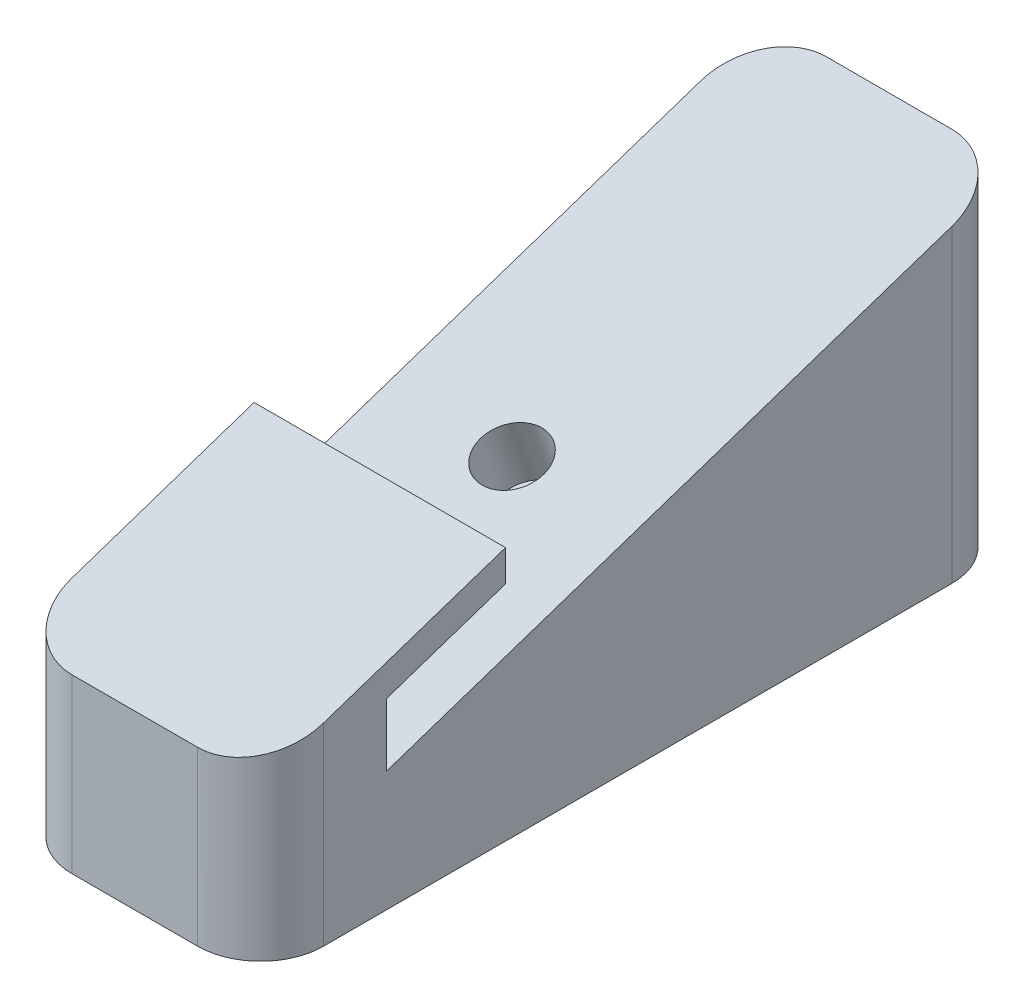
from build123d import *

# Parameters (mm, degrees)
SKETCH1_W               = 25.4
SKETCH1_H               = 76.2
BOSS_EXTRUDE1_DEPTH     = 33.3756
CUT_EXTRUDE2_DEPTH      = 57.663045059
CUT_EXTRUDE2_DEPTH_BACK = 57.663045059
SKETCH5_R               = 3.175
CUT_EXTRUDE3_DEPTH      = 6.35
BOSS_EXTRUDE2_REACH     = 63.744
SKETCH1_5_W             = 25.4
SKETCH1_5_H             = 12.7
SKETCH7_W               = 25.4
SKETCH7_H               = 3.175
BOSS_EXTRUDE3_DEPTH     = 12.7
FILLET1_R               = 6.35


with BuildPart() as part:
    # Sketch1 → Boss-Extrude1 (new body)
    with BuildSketch(Plane(origin=(0, 0, 0), x_dir=(1, 0, 0), z_dir=(0, 1, 0))):
        Rectangle(SKETCH1_W, SKETCH1_H)
    extrude(amount=BOSS_EXTRUDE1_DEPTH)

    # Sketch4 → Cut-Extrude2 (cut, two sides: drawn at the far end of the back side and taken through both)
    with BuildSketch(Plane(origin=(12.7, 0, 0), x_dir=(0, 0, -1), z_dir=(1, 0, 0)).offset(-CUT_EXTRUDE2_DEPTH_BACK)):
        Polygon((38.1, 33.3756), (-38.1, 33.3756), (-38.1, 7.879436654), align=None)
    extrude(amount=CUT_EXTRUDE2_DEPTH + CUT_EXTRUDE2_DEPTH_BACK, mode=Mode.SUBTRACT)

    # Sketch5 → Cut-Extrude3 (cut)
    with BuildSketch(Plane(origin=(0, 18.550693474, 6.20697521), x_dir=(1, 0, 0), z_dir=(0, 0.9483236552061992, 0.3173046564050927))):
        with Locations((0, 6.545207615)):
            Circle(SKETCH5_R)
    extrude(amount=-CUT_EXTRUDE3_DEPTH, mode=Mode.SUBTRACT)

    # Boss-Extrude2: from a plane face, 63.744 long prism both ways, kept between that surface and its translate by the depth
    boss_extrude2_start = Plane(origin=(-12.7, 7.879436654, 38.1), z_dir=(0, -0.9483236552061992, -0.3173046564050927)) * Box(256.976, 256.976, 128.488, align=(Align.CENTER, Align.CENTER, Align.MIN), mode=Mode.PRIVATE)
    boss_extrude2_end = Plane(origin=(-12.7, 17.404436654, 38.1), z_dir=(0, -0.9483236552061992, -0.3173046564050927)) * Box(256.976, 256.976, 128.488, align=(Align.CENTER, Align.CENTER, Align.MIN), mode=Mode.PRIVATE)
    # Sketch1<5> → Boss-Extrude2 (add, from a surface)
    with BuildSketch(Plane(origin=(0, 0, 0), x_dir=(1, 0, 0), z_dir=(0, 1, 0)), mode=Mode.PRIVATE) as boss_extrude2_sk1:
        with Locations((0, -31.75)):
            Rectangle(SKETCH1_5_W, SKETCH1_5_H)
    boss_extrude2_tool1 = extrude(boss_extrude2_sk1.sketch, amount=BOSS_EXTRUDE2_REACH, both=True, mode=Mode.PRIVATE)
    add(((boss_extrude2_tool1 - boss_extrude2_start) & boss_extrude2_end).solids().sort_by_distance((0, 19.620076, 3.010928))[0])

    # Sketch7 → Boss-Extrude3 (add, along a direction that is not the sketch's normal)
    with BuildSketch(Plane(origin=(0, 0, 25.4), x_dir=(-1, 0, 0), z_dir=(0, 0, -1))):
        with Locations((0, 20.066297212)):
            Rectangle(SKETCH7_W, SKETCH7_H)
    extrude(amount=BOSS_EXTRUDE3_DEPTH, dir=(0, 0.31730465640509264, -0.9483236552061991))

    # Fillet1
    fillet1_edges = [part.edges().sort_by_distance(p)[0] for p in [
        (-12.7, 16.6878, -38.1),
        (-12.7, 8.702218327, 38.1),
        (12.7, 16.6878, -38.1),
        (12.7, 8.702218327, 38.1),
    ]]
    fillet(fillet1_edges, radius=FILLET1_R)


solid = part.part
